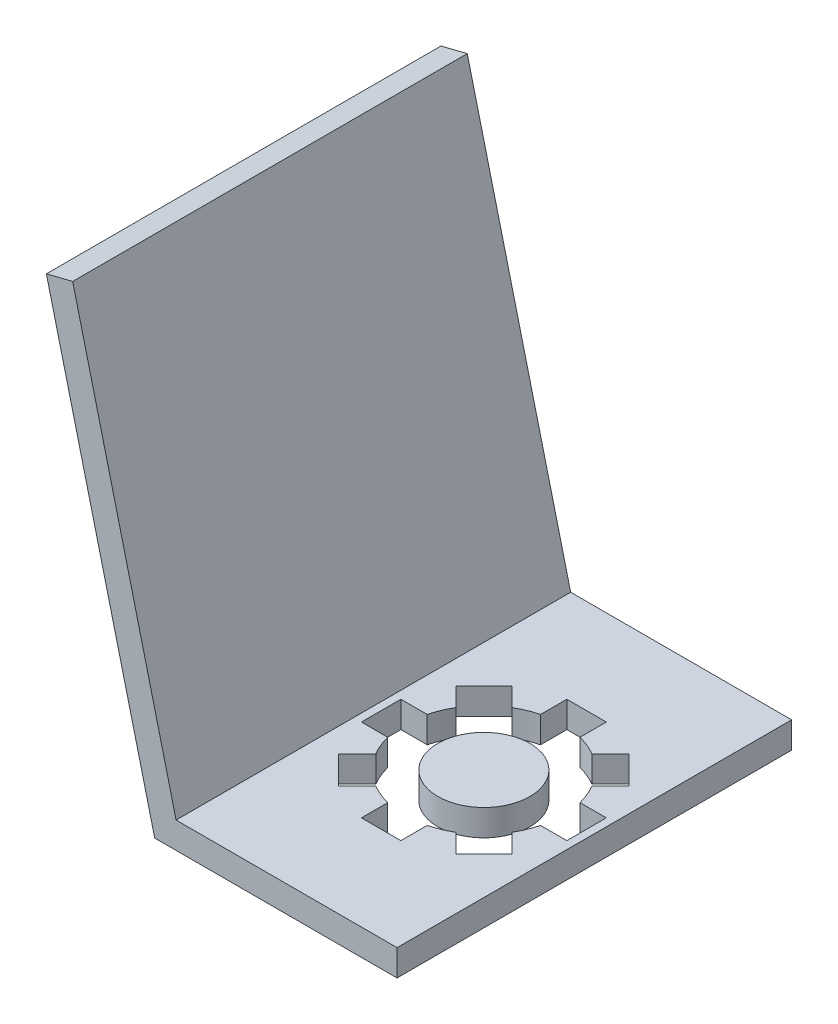
from build123d import *

# Parameters (mm, degrees)
BOSS_EXTRUDE1_DEPTH = 762
SKETCH2_R           = 88.9
CUT_EXTRUDE1_DEPTH  = 1016


with BuildPart() as part:
    # Sketch1 → Boss-Extrude1 (new body)
    with BuildSketch(Plane.XY):
        Polygon((0, 0), (426.72, 0), (426.72, -50.8), (-41.292091668, -50.8), (-250.506524818, 788.313259496), (-199.706524818, 800.979122041), align=None)
    extrude(amount=BOSS_EXTRUDE1_DEPTH)

    # Sketch2 → Cut-Extrude1 (cut)
    with BuildSketch(Plane(origin=(0, 0, 0), x_dir=(1, 0, 0), z_dir=(0, 1, 0))):
        with BuildLine():
            Line((175.26, -182.639334509), (251.46, -182.639334509))
            Line((251.46, -182.639334509), (251.46, -233.439334509))
            ThreePointArc((251.46, -233.439334509), (271.680955092, -240.200759245), (290.760378842, -249.718084432))
            Line((290.760378842, -249.718084432), (326.681403326, -213.797059948))
            Line((326.681403326, -213.797059948), (380.562940052, -267.678596674))
            Line((380.562940052, -267.678596674), (344.641915568, -303.599621158))
            ThreePointArc((344.641915568, -303.599621158), (354.159240755, -322.679044908), (360.920665491, -342.9))
            Line((360.920665491, -342.9), (411.720665491, -342.9))
            Line((411.720665491, -342.9), (411.720665491, -419.1))
            Line((411.720665491, -419.1), (360.920665491, -419.1))
            ThreePointArc((360.920665491, -419.1), (354.159240755, -439.320955092), (344.641915568, -458.400378842))
            Line((344.641915568, -458.400378842), (380.562940052, -494.321403326))
            Line((380.562940052, -494.321403326), (326.681403326, -548.202940052))
            Line((326.681403326, -548.202940052), (290.760378842, -512.281915568))
            ThreePointArc((290.760378842, -512.281915568), (271.680955092, -521.799240755), (251.46, -528.560665491))
            Line((251.46, -528.560665491), (251.46, -579.360665491))
            Line((251.46, -579.360665491), (175.26, -579.360665491))
            Line((175.26, -579.360665491), (175.26, -528.560665491))
            ThreePointArc((175.26, -528.560665491), (155.039044908, -521.799240755), (135.959621158, -512.281915568))
            Line((135.959621158, -512.281915568), (100.038596674, -548.202940052))
            Line((100.038596674, -548.202940052), (46.157059948, -494.321403326))
            Line((46.157059948, -494.321403326), (82.078084432, -458.400378842))
            ThreePointArc((82.078084432, -458.400378842), (72.560759245, -439.320955092), (65.79933451, -419.1))
            Line((65.79933451, -419.1), (14.99933451, -419.1))
            Line((14.99933451, -419.1), (14.99933451, -342.9))
            Line((14.99933451, -342.9), (65.79933451, -342.9))
            ThreePointArc((65.79933451, -342.9), (72.560759245, -322.679044908), (82.078084432, -303.599621158))
            Line((82.078084432, -303.599621158), (46.157059948, -267.678596674))
            Line((46.157059948, -267.678596674), (100.038596674, -213.797059948))
            Line((100.038596674, -213.797059948), (135.959621158, -249.718084432))
            ThreePointArc((135.959621158, -249.718084432), (155.039044908, -240.200759245), (175.26, -233.439334509))
            Line((175.26, -233.439334509), (175.26, -182.639334509))
        make_face()
        with Locations(Location((213.36, -381, 0), (0, 0, 270))):
            Circle(SKETCH2_R, mode=Mode.SUBTRACT)
    extrude(amount=-CUT_EXTRUDE1_DEPTH, mode=Mode.SUBTRACT)


with BuildPart() as cut_extrude1_piece_1:
    # of the separate pieces the step leaves, piece 1, a body of its own (cut_extrude1_pieces)
    add(part.part.solids().sort_by_distance((0, 0, 0))[0])


with BuildPart() as cut_extrude1_piece_2:
    # of the separate pieces the step leaves, piece 2, a body of its own (cut_extrude1_pieces)
    add(part.part.solids().sort_by_distance((213.36, 0, 469.9))[0])


solid = Compound([cut_extrude1_piece_1.part, cut_extrude1_piece_2.part])
